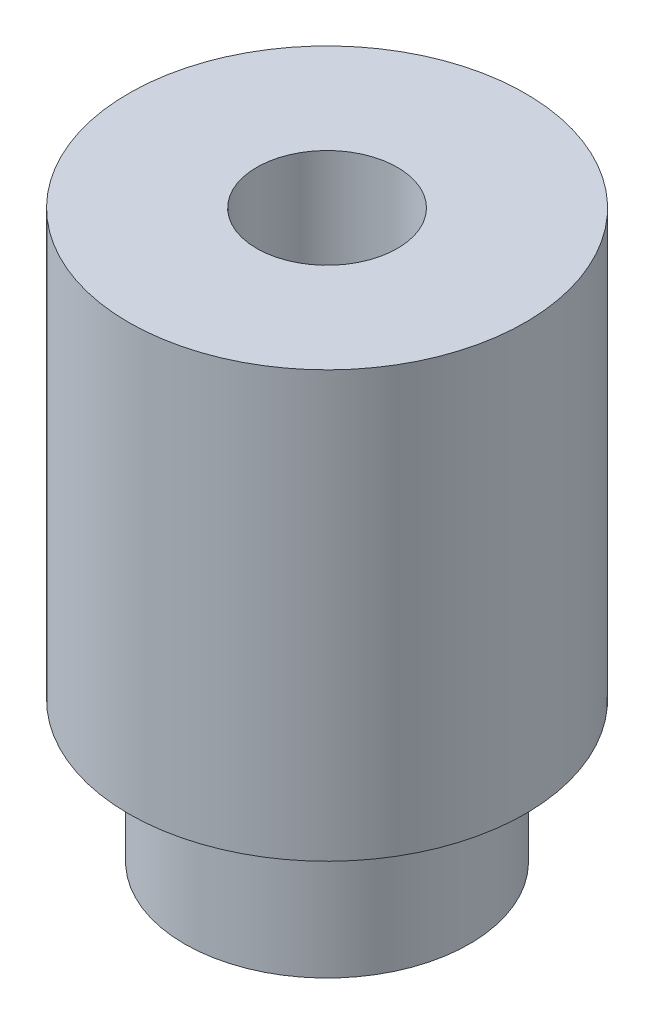
from build123d import *

# Parameters (mm, degrees)
SKETCH1_R           = 10.033
BOSS_EXTRUDE1_DEPTH = 9.906
SKETCH2_R           = 13.97
BOSS_EXTRUDE2_DEPTH = 29.972
SKETCH3_R           = 4.953
CUT_EXTRUDE1_DEPTH  = 45.503670455


with BuildPart() as part:
    # Sketch1 → Boss-Extrude1 (new body)
    with BuildSketch(Plane(origin=(0, 0, 0), x_dir=(1, 0, 0), z_dir=(0, 1, 0))):
        with Locations(Location((0, 0, 0), (0, 0, 270))):
            Circle(SKETCH1_R)
    extrude(amount=BOSS_EXTRUDE1_DEPTH)

    # Sketch2 → Boss-Extrude2 (add)
    with BuildSketch(Plane(origin=(0, 9.906, 0), x_dir=(1, 0, 0), z_dir=(0, 1, 0))):
        with Locations(Location((0, 0, 0), (0, 0, 270))):
            Circle(SKETCH2_R)
    extrude(amount=BOSS_EXTRUDE2_DEPTH)

    # Sketch3 → Cut-Extrude1 (cut, through all)
    with BuildSketch(Plane(origin=(0, 39.878, 0), x_dir=(1, 0, 0), z_dir=(0, 1, 0))):
        with Locations(Location((0, 0, 0), (0, 0, 270))):
            Circle(SKETCH3_R)
    extrude(amount=-CUT_EXTRUDE1_DEPTH, mode=Mode.SUBTRACT)


solid = part.part
